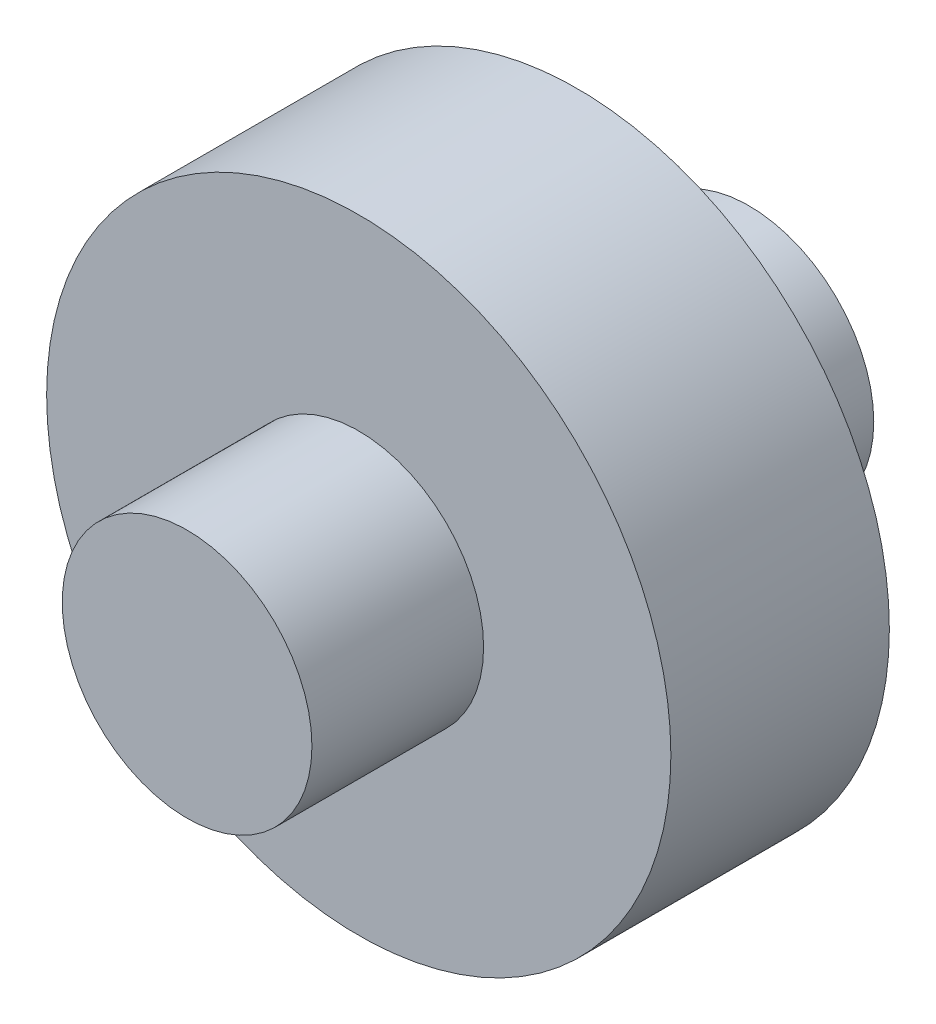
from build123d import *

# Parameters (mm, degrees)
SKETCH_1_R      = 4
EXTRUDE_2_DEPTH = 9
SKETCH_1_6_R    = 10
SKETCH_1_6_R_2  = 4
EXTRUDE_3_DEPTH = 3.5


with BuildPart() as part:
    # 草图1 → 凸台-拉伸2 (new, symmetric)
    with BuildSketch(Plane.XY):
        Circle(SKETCH_1_R)
    extrude(amount=EXTRUDE_2_DEPTH, both=True)

    # 草图1<6> → 凸台-拉伸3 (add, symmetric)
    with BuildSketch(Plane.XY):
        Circle(SKETCH_1_6_R)
        Circle(SKETCH_1_6_R_2, mode=Mode.SUBTRACT)
    extrude(amount=EXTRUDE_3_DEPTH, both=True)


solid = part.part
